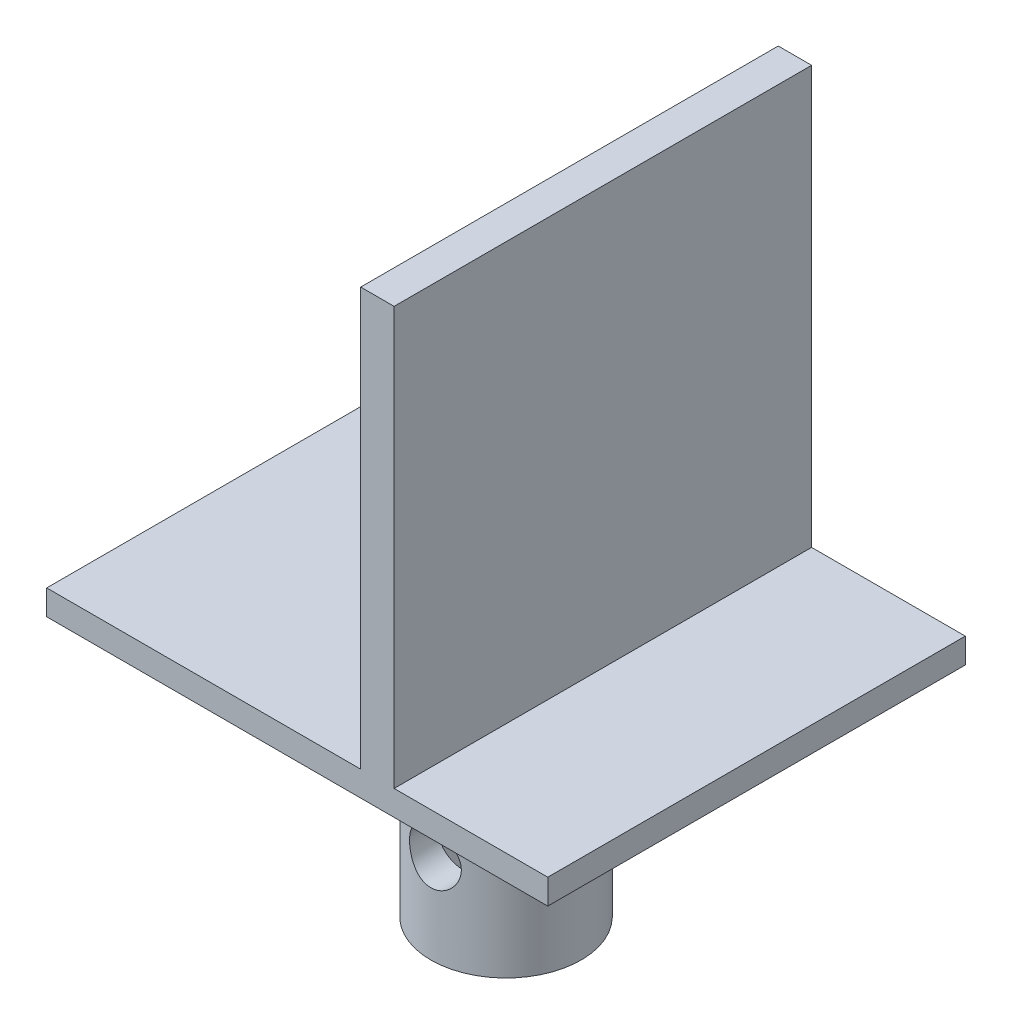
from build123d import *

# Parameters (mm, degrees)
SKETCH_1_R               = 4.5
SKETCH_1_R_2             = 3.1
EXTRUDE_1_DEPTH          = 14.3
EXTRUDE_START            = -11.25
EXTRUDE_2_DEPTH          = 11.25
CUT_EXTRUDE_1_DEPTH      = 16.652156401
CUT_EXTRUDE_1_DEPTH_BACK = 16.652156401
SKETCH_3_R               = 1.55
SKETCH_4_W               = 30
SKETCH_4_H               = 25
EXTRUDE_3_DEPTH          = 1.5
SKETCH_5_R               = 1.6
CUT_EXTRUDE_2_DEPTH      = 26.117523826
SKETCH_6_W               = 2
SKETCH_6_H               = 25
EXTRUDE_4_DEPTH          = 25


with BuildPart() as part:
    # 草图1 → 凸台-拉伸1 (new body)
    with BuildSketch(Plane(origin=(0, 0, 0), x_dir=(1, 0, 0), z_dir=(0, 1, 0))):
        with Locations(Location((0, 0, 0), (0, 0, 270))):
            Circle(SKETCH_1_R)
        with Locations(Location((0, 0, 0), (0, 0, 270))):
            Circle(SKETCH_1_R_2, mode=Mode.SUBTRACT)
    extrude(amount=EXTRUDE_1_DEPTH)

    # 草图2 → 凸台-拉伸2 (add)
    with BuildSketch(Plane(origin=(0, 14.3, 0), x_dir=(1, 0, 0), z_dir=(0, 1, 0)).offset(EXTRUDE_START)):
        with BuildLine():
            Line((-1.688194302, -2.6), (1.688194302, -2.6))
            ThreePointArc((1.688194302, -2.6), (0, -3.1), (-1.688194302, -2.6))
        make_face()
    extrude(amount=EXTRUDE_2_DEPTH)

    # 草图3 → 切除-拉伸1 (cut, two sides: drawn at the far end of the back side and taken through both)
    with BuildSketch(Plane.XY.offset(-CUT_EXTRUDE_1_DEPTH_BACK)):
        with Locations((0, 5.3)):
            Circle(SKETCH_3_R)
    extrude(amount=CUT_EXTRUDE_1_DEPTH + CUT_EXTRUDE_1_DEPTH_BACK, mode=Mode.SUBTRACT)

    # 草图4 → 凸台-拉伸3 (add)
    with BuildSketch(Plane(origin=(0, 14.3, 0), x_dir=(1, 0, 0), z_dir=(0, 1, 0))):
        Rectangle(SKETCH_4_W, SKETCH_4_H)
    extrude(amount=EXTRUDE_3_DEPTH)

    # 草图5 → 切除-拉伸2 (cut, through all)
    with BuildSketch(Plane(origin=(0, 15.8, 0), x_dir=(1, 0, 0), z_dir=(0, 1, 0))):
        with Locations(Location((0, 0, 0), (0, 0, 270))):
            Circle(SKETCH_5_R)
    extrude(amount=-CUT_EXTRUDE_2_DEPTH, mode=Mode.SUBTRACT)

    # 草图6 → 凸台-拉伸4 (add)
    with BuildSketch(Plane(origin=(0, 15.8, 0), x_dir=(1, 0, 0), z_dir=(0, 1, 0))):
        with Locations((4.8, 0)):
            Rectangle(SKETCH_6_W, SKETCH_6_H)
    extrude(amount=EXTRUDE_4_DEPTH)


solid = part.part
